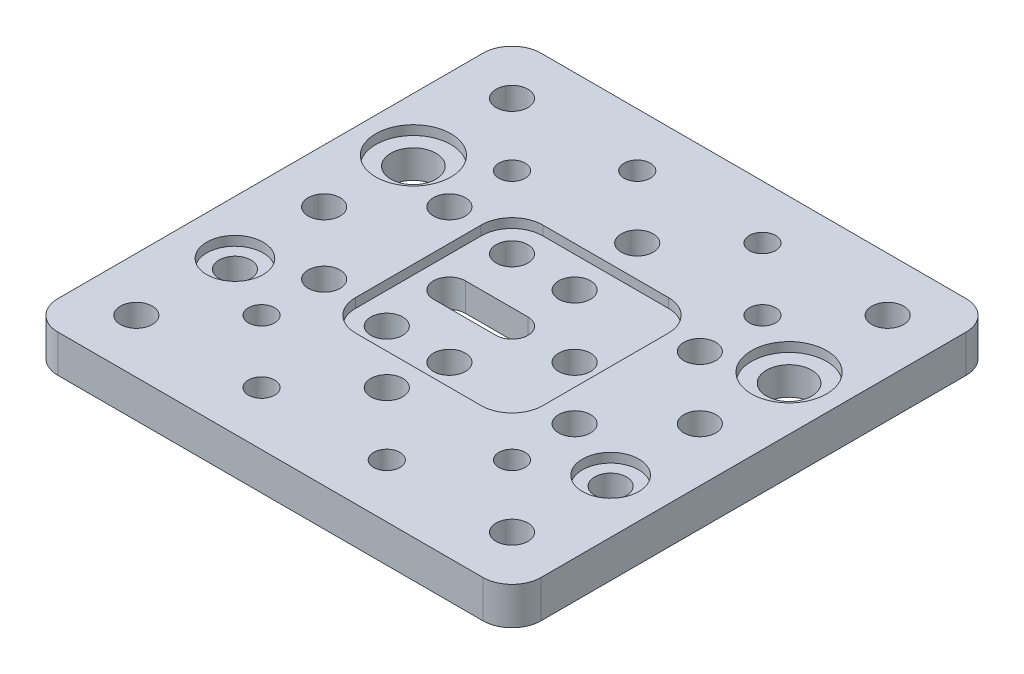
from build123d import *

# Parameters (mm, degrees)
SKETCH1_R             = 3.6
SKETCH1_R_2           = 2.55
BOSS_EXTRUDE1_DEPTH   = 6
M5X0_8_TAPPED_HOLE1_D = 4.2
SKETCH2_R             = 6
SKETCH2_R_2           = 4.5
CUT_EXTRUDE1_DEPTH    = 1.5


with BuildPart() as part:
    # Sketch1 → Boss-Extrude1 (new body)
    with BuildSketch(Plane(origin=(0, 0, 0), x_dir=(1, 0, 0), z_dir=(0, 1, 0))):
        with BuildLine():
            Line((33.94, -38.575), (-33.94, -38.575))
            ThreePointArc((-33.94, -38.575), (-37.217439931, -37.217439931), (-38.575, -33.94))
            Line((-38.575, -33.94), (-38.575, 33.94))
            ThreePointArc((-38.575, 33.94), (-37.217439931, 37.217439931), (-33.94, 38.575))
            Line((-33.94, 38.575), (33.94, 38.575))
            ThreePointArc((33.94, 38.575), (37.217439931, 37.217439931), (38.575, 33.94))
            Line((38.575, 33.94), (38.575, -33.94))
            ThreePointArc((38.575, -33.94), (37.217439931, -37.217439931), (33.94, -38.575))
        make_face()
        with Locations(Location((-30, 14.25, 0), (0, 0, 270))):
            Circle(SKETCH1_R, mode=Mode.SUBTRACT)
        with Locations(Location((-20, 10, 0), (0, 0, 270))):
            Circle(SKETCH1_R_2, mode=Mode.SUBTRACT)
        with Locations(Location((0, 20, 0), (0, 0, 270))):
            Circle(SKETCH1_R_2, mode=Mode.SUBTRACT)
        with Locations(Location((0, 10, 0), (0, 0, 270))):
            Circle(SKETCH1_R_2, mode=Mode.SUBTRACT)
        with Locations(Location((-10, 10, 0), (0, 0, 270))):
            Circle(SKETCH1_R_2, mode=Mode.SUBTRACT)
        with Locations(Location((-30, 30, 0), (0, 0, 270))):
            Circle(SKETCH1_R_2, mode=Mode.SUBTRACT)
        with Locations(Location((-30, 0, 0), (0, 0, 270))):
            Circle(SKETCH1_R_2, mode=Mode.SUBTRACT)
        with Locations(Location((30, 30, 0), (0, 0, 90))):
            Circle(SKETCH1_R_2, mode=Mode.SUBTRACT)
        with Locations(Location((30, 14.25, 0), (0, 0, 90))):
            Circle(SKETCH1_R, mode=Mode.SUBTRACT)
        with Locations(Location((30, 0, 0), (0, 0, 90))):
            Circle(SKETCH1_R_2, mode=Mode.SUBTRACT)
        with Locations(Location((20, 10, 0), (0, 0, 90))):
            Circle(SKETCH1_R_2, mode=Mode.SUBTRACT)
        with Locations(Location((20, -10, 0), (0, 0, 270))):
            Circle(SKETCH1_R_2, mode=Mode.SUBTRACT)
        with Locations(Location((-30, -30, 0), (0, 0, 90))):
            Circle(SKETCH1_R_2, mode=Mode.SUBTRACT)
        with Locations(Location((30, -30, 0), (0, 0, 270))):
            Circle(SKETCH1_R_2, mode=Mode.SUBTRACT)
        with Locations(Location((-20, -10, 0), (0, 0, 90))):
            Circle(SKETCH1_R_2, mode=Mode.SUBTRACT)
        with Locations(Location((0, -20, 0), (0, 0, 90))):
            Circle(SKETCH1_R_2, mode=Mode.SUBTRACT)
        with Locations(Location((0, -10, 0), (0, 0, 90))):
            Circle(SKETCH1_R_2, mode=Mode.SUBTRACT)
        with Locations(Location((-10, -10, 0), (0, 0, 90))):
            Circle(SKETCH1_R_2, mode=Mode.SUBTRACT)
        with Locations(Location((10, 0, 0), (0, 0, 270))):
            Circle(SKETCH1_R_2, mode=Mode.SUBTRACT)
        with Locations(Location((30, -14.25, 0), (0, 0, 270))):
            Circle(SKETCH1_R_2, mode=Mode.SUBTRACT)
        with Locations(Location((-30, -14.25, 0), (0, 0, 90))):
            Circle(SKETCH1_R_2, mode=Mode.SUBTRACT)
        with BuildLine():
            Line((0, -2.55), (-10, -2.55))
            ThreePointArc((-10, -2.55), (-12.55, 0), (-10, 2.55))
            Line((-10, 2.55), (0, 2.55))
            ThreePointArc((0, 2.55), (2.55, 0), (0, -2.55))
        make_face(mode=Mode.SUBTRACT)
    extrude(amount=BOSS_EXTRUDE1_DEPTH)

    # M5x0.8 Tapped Hole1 (through all)
    with Locations(Plane(origin=(0, 6, 0), x_dir=(1, 0, 0), z_dir=(0, 1, 0))):
        with Locations((-20, 20), (-10, 30), (10, 30), (20, 20), (20, -20), (10, -30), (-10, -30), (-20, -20)):
            Hole(M5X0_8_TAPPED_HOLE1_D / 2)

    # Sketch2 → Cut-Extrude1 (cut)
    with BuildSketch(Plane(origin=(0, 6, 0), x_dir=(1, 0, 0), z_dir=(0, 1, 0))):
        with Locations(Location((-30, 14.25, 0), (0, 0, 270))):
            Circle(SKETCH2_R)
        with Locations(Location((30, 14.25, 0), (0, 0, 270))):
            Circle(SKETCH2_R)
        with Locations(Location((30, -14.25, 0), (0, 0, 270))):
            Circle(SKETCH2_R_2)
        with Locations(Location((-30, -14.25, 0), (0, 0, 270))):
            Circle(SKETCH2_R_2)
        with BuildLine():
            Line((10.03, -14.95), (-10.03, -14.95))
            ThreePointArc((-10.03, -14.95), (-13.508965363, -13.508965363), (-14.95, -10.03))
            Line((-14.95, -10.03), (-14.95, 10.03))
            ThreePointArc((-14.95, 10.03), (-13.508965363, 13.508965363), (-10.03, 14.95))
            Line((-10.03, 14.95), (10.03, 14.95))
            ThreePointArc((10.03, 14.95), (13.508965363, 13.508965363), (14.95, 10.03))
            Line((14.95, 10.03), (14.95, -10.03))
            ThreePointArc((14.95, -10.03), (13.508965363, -13.508965363), (10.03, -14.95))
        make_face()
    extrude(amount=-CUT_EXTRUDE1_DEPTH, mode=Mode.SUBTRACT)


solid = part.part
